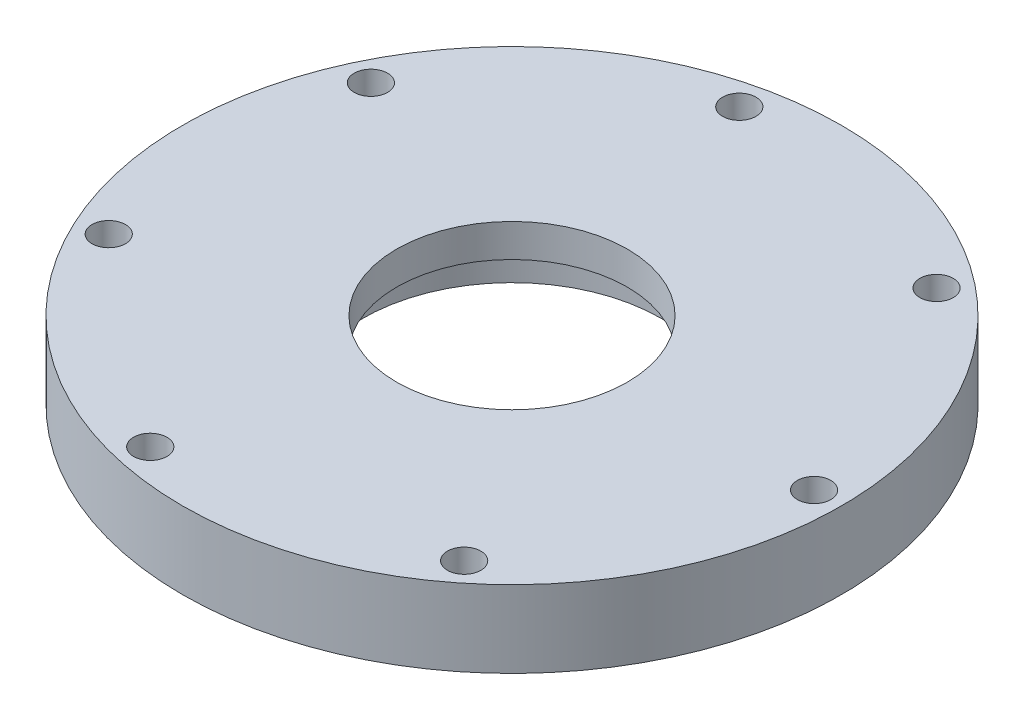
from build123d import *

# Parameters (mm, degrees)
CROQUIS1_R              = 30
CROQUIS1_R_2            = 10.5
SALIENTE_EXTRUIR1_DEPTH = 7
CROQUIS2_R              = 13.575
CORTAR_EXTRUIR1_DEPTH   = 4
CROQUIS3_R              = 1.52
CORTAR_EXTRUIR2_DEPTH   = 44


with BuildPart() as part:
    # Croquis1 → Saliente-Extruir1 (new body)
    with BuildSketch(Plane(origin=(0, 0, 0), x_dir=(1, 0, 0), z_dir=(0, 1, 0))):
        with Locations(Location((0, 0, 0), (0, 0, 270))):
            Circle(CROQUIS1_R)
        with Locations(Location((0, 0, 0), (0, 0, 270))):
            Circle(CROQUIS1_R_2, mode=Mode.SUBTRACT)
    extrude(amount=SALIENTE_EXTRUIR1_DEPTH)

    # Croquis2 → Cortar-Extruir1 (cut)
    with BuildSketch(Plane.XZ):
        with Locations(Location((0, 0, 0), (0, 0, 270))):
            Circle(CROQUIS2_R)
    extrude(amount=-CORTAR_EXTRUIR1_DEPTH, mode=Mode.SUBTRACT)

    # Croquis3 → Cortar-Extruir2 (cut, through all)
    with BuildSketch(Plane(origin=(0, 7, 0), x_dir=(1, 0, 0), z_dir=(0, 1, 0))):
        with Locations(Location((27.5, 0, 0), (0, 0, 270))):
            Circle(CROQUIS3_R)
        with Locations(Location((17.145969551, -21.500365768, 0), (0, 0, 270))):
            Circle(CROQUIS3_R)
        with Locations(Location((-6.119325684, -26.810517585, 0), (0, 0, 270))):
            Circle(CROQUIS3_R)
        with Locations(Location((-24.776643867, -11.931802826, 0), (0, 0, 270))):
            Circle(CROQUIS3_R)
        with Locations(Location((-24.776643867, 11.931802826, 0), (0, 0, 270))):
            Circle(CROQUIS3_R)
        with Locations(Location((-6.119325684, 26.810517585, 0), (0, 0, 270))):
            Circle(CROQUIS3_R)
        with Locations(Location((17.145969551, 21.500365768, 0), (0, 0, 270))):
            Circle(CROQUIS3_R)
    extrude(amount=-CORTAR_EXTRUIR2_DEPTH, mode=Mode.SUBTRACT)


solid = part.part
